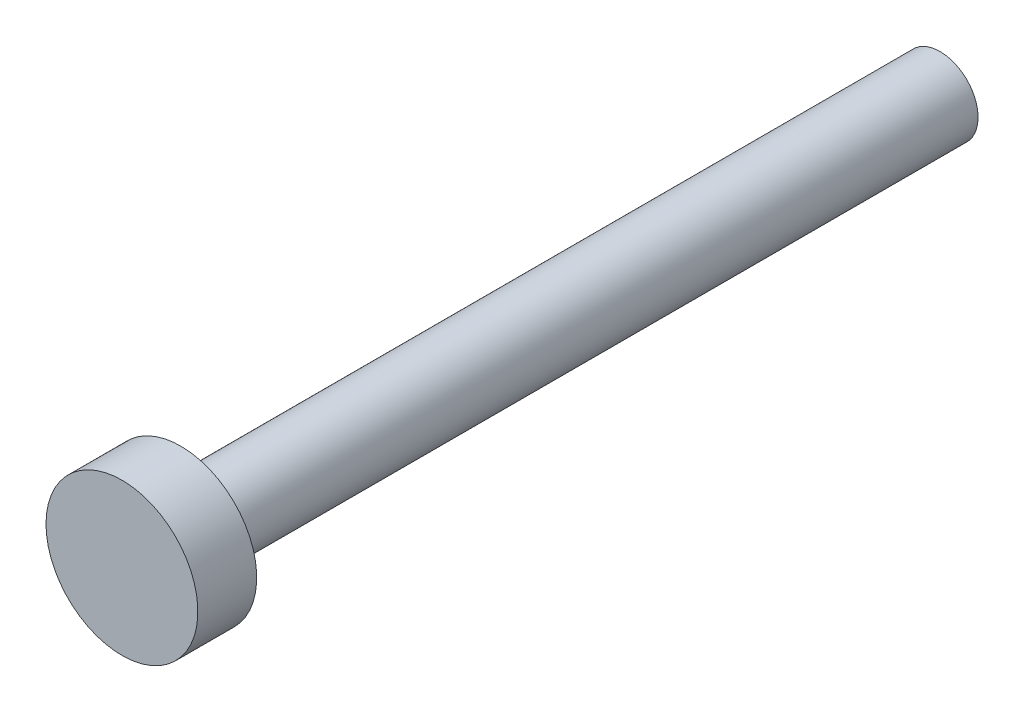
from build123d import *

# Parameters (mm, degrees)
ESQUISSE1_R        = 4
BOSS_EXTRU_1_DEPTH = 3.1
ESQUISSE2_R        = 2
BOSS_EXTRU_2_DEPTH = 40


with BuildPart() as part:
    # Esquisse1 → Boss.-Extru.1 (new body)
    with BuildSketch(Plane.XY):
        with Locations(Location((0, 0, 0), (0, 0, 180))):
            Circle(ESQUISSE1_R)
    extrude(amount=BOSS_EXTRU_1_DEPTH)

    # Esquisse2 → Boss.-Extru.2 (add)
    with BuildSketch(Plane(origin=(0, 0, 0), x_dir=(-1, 0, 0), z_dir=(0, 0, -1))):
        Circle(ESQUISSE2_R)
    extrude(amount=BOSS_EXTRU_2_DEPTH)


solid = part.part
